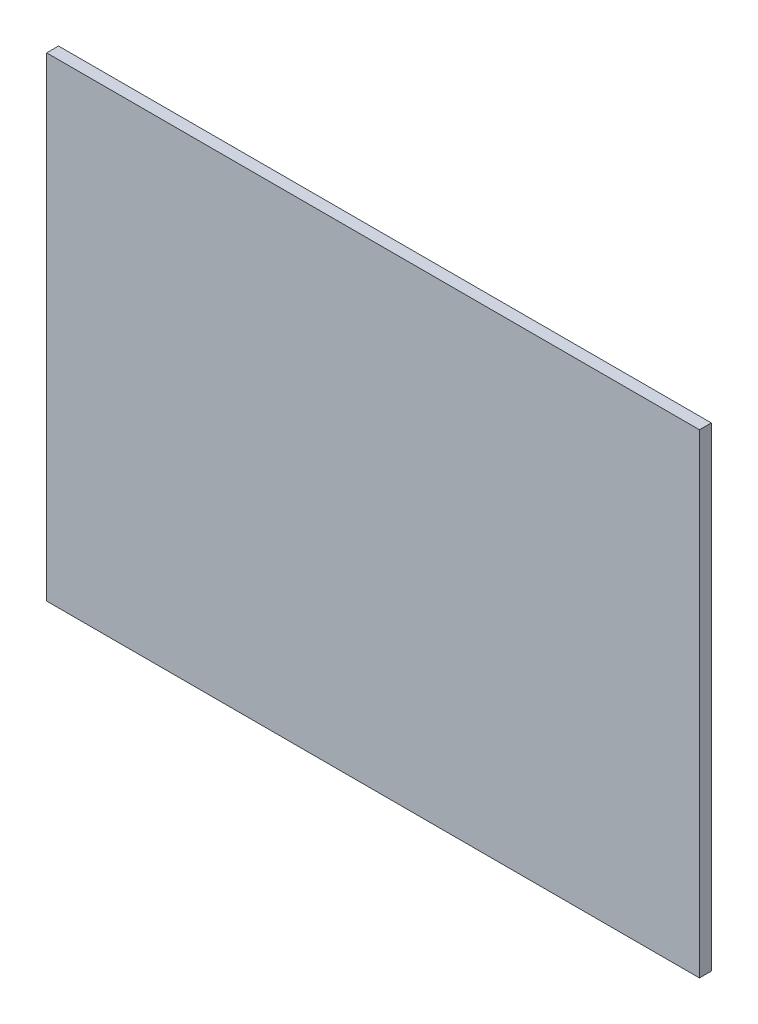
from build123d import *

# Parameters (mm, degrees)
SKETCH1_W           = 220
SKETCH1_H           = 160
BOSS_EXTRUDE1_DEPTH = 4


with BuildPart() as part:
    # Sketch1 → Boss-Extrude1 (new body)
    with BuildSketch(Plane.XY):
        Rectangle(SKETCH1_W, SKETCH1_H)
    extrude(amount=BOSS_EXTRUDE1_DEPTH)


solid = part.part
